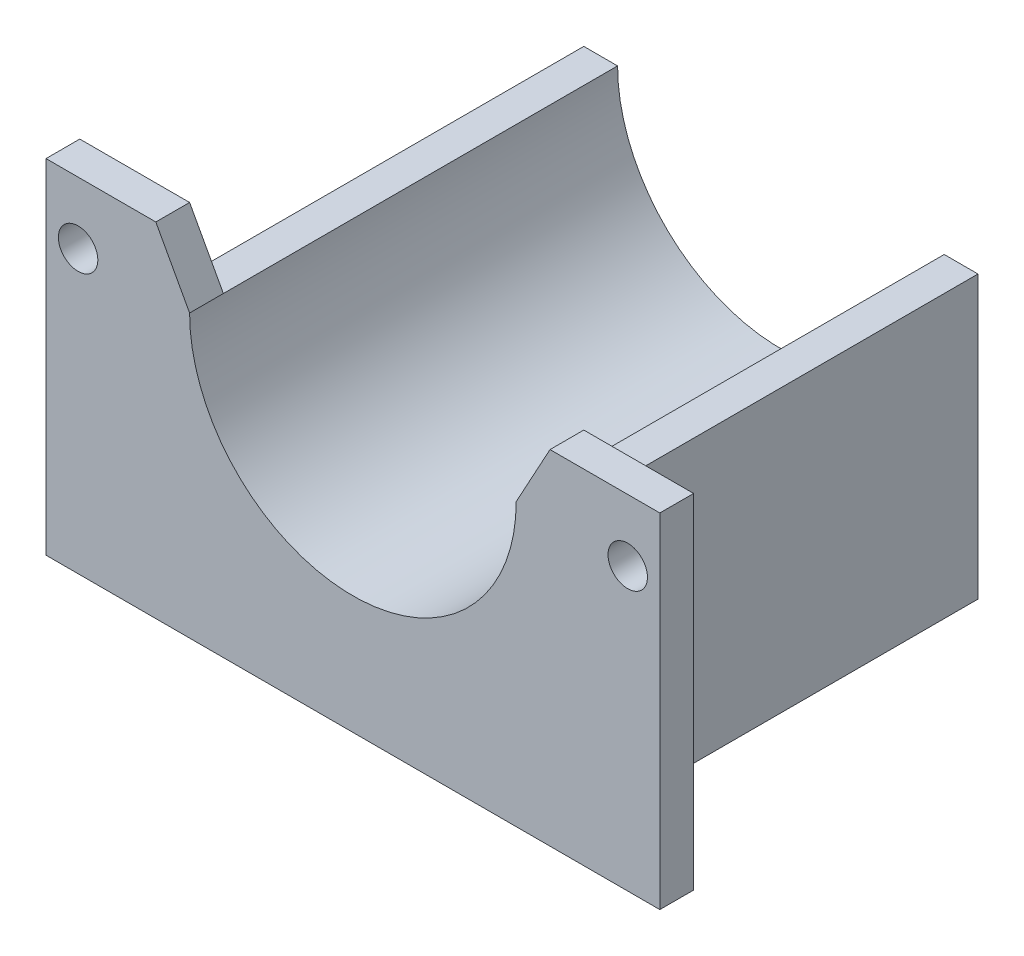
from build123d import *

# Parameters (mm, degrees)
EXTRUDE_1_DEPTH     = 35
SKETCH_2_W          = 54.5
SKETCH_2_H          = 30.5
SKETCH_2_R          = 1.75
EXTRUDE_2_DEPTH     = 3
CUT_EXTRUDE_2_DEPTH = 63.069014009


with BuildPart() as part:
    # Эскиз1 → Бобышка-Вытянуть1 (new body)
    with BuildSketch(Plane.XY):
        with BuildLine():
            Line((-32, 0), (-35, 0))
            Line((-35, 0), (-35, -25))
            Line((-35, -25), (0, -25))
            Line((0, -25), (0, 0))
            Line((0, 0), (-3, 0))
            ThreePointArc((-3, 0), (-17.5, -14.5), (-32, 0))
        make_face()
    extrude(amount=EXTRUDE_1_DEPTH)

    # Эскиз2 → Бобышка-Вытянуть2 (add)
    with BuildSketch(Plane.XY.offset(35)):
        with Locations((-17.5, -9.75)):
            Rectangle(SKETCH_2_W, SKETCH_2_H)
        with Locations((6.9, 0)):
            Circle(SKETCH_2_R, mode=Mode.SUBTRACT)
        with Locations(Location((-41.9, 0, 0), (0, 0, 180))):
            Circle(SKETCH_2_R, mode=Mode.SUBTRACT)
    extrude(amount=EXTRUDE_2_DEPTH)

    # Эскиз3 → Вырез-Вытянуть2 (cut, through all)
    with BuildSketch(Plane(origin=(0, 0, 35), x_dir=(-1, 0, 0), z_dir=(0, 0, -1))):
        with BuildLine():
            Line((3, 0), (0, 5.5))
            Line((0, 5.5), (35, 5.5))
            Line((35, 5.5), (32, 0))
            ThreePointArc((32, 0), (17.5, -14.5), (3, 0))
        make_face()
    extrude(amount=-CUT_EXTRUDE_2_DEPTH, mode=Mode.SUBTRACT)


solid = part.part
